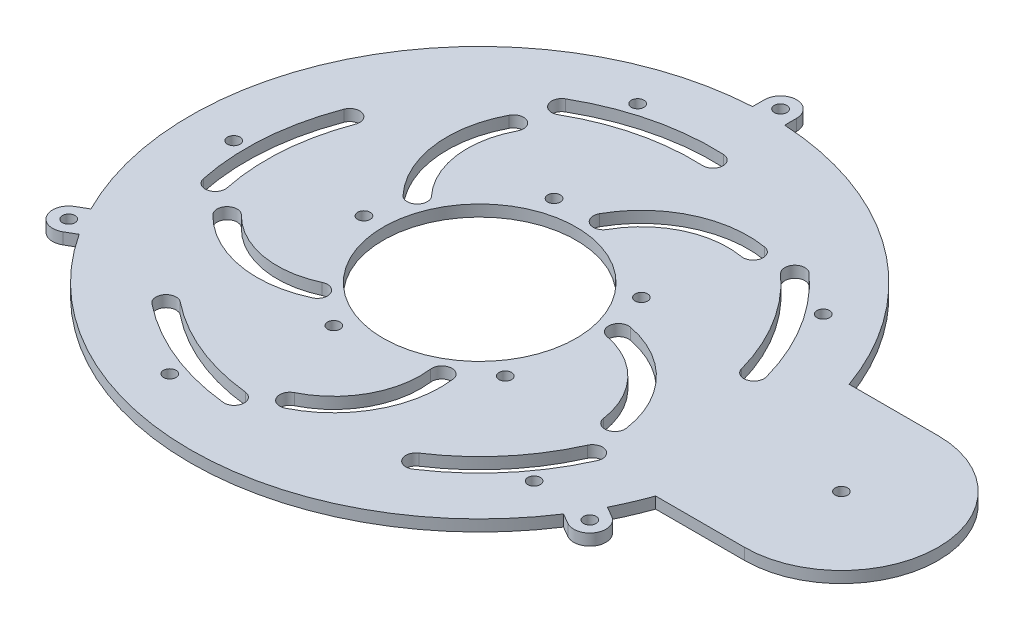
from build123d import *

# Parameters (mm, degrees)
SKETCH1_R           = 50.8
SKETCH1_R_2         = 3.3
BOSS_EXTRUDE1_DEPTH = 6


with BuildPart() as part:
    # Sketch1 → Boss-Extrude1 (new body)
    with BuildSketch(Plane(origin=(0, 0, 0), x_dir=(1, 0, 0), z_dir=(0, 1, 0))):
        with BuildLine():
            Line((190.5, 50.961251532), (143.626985077, 50.961251532))
            ThreePointArc((143.626985077, 50.961251532), (91.342451877, 121.993100154), (8.463835644, 152.16479056))
            Line((8.463835644, 152.16479056), (8.463835644, 158.450241569))
            ThreePointArc((8.463835644, 158.450241569), (0, 166.914077214), (-8.463835644, 158.450241569))
            Line((-8.463835644, 158.450241569), (-8.463835644, 152.16479056))
            ThreePointArc((-8.463835644, 152.16479056), (-131.982271537, 76.2), (-136.010492009, -68.752498599))
            Line((-136.010492009, -68.752498599), (-141.453852257, -71.895224103))
            ThreePointArc((-141.453852257, -71.895224103), (-144.551831116, -83.457038607), (-132.990016613, -86.555017466))
            Line((-132.990016613, -86.555017466), (-127.546656365, -83.412291961))
            ThreePointArc((-127.546656365, -83.412291961), (0, -152.4), (127.546656365, -83.412291961))
            Line((127.546656365, -83.412291961), (132.990016613, -86.555017466))
            ThreePointArc((132.990016613, -86.555017466), (144.551831116, -83.457038607), (141.453852257, -71.895224103))
            Line((141.453852257, -71.895224103), (136.010492009, -68.752498599))
            ThreePointArc((136.010492009, -68.752498599), (140.101433846, -59.977897881), (143.626985077, -50.961251532))
            Line((143.626985077, -50.961251532), (190.5, -50.961251532))
            ThreePointArc((190.5, -50.961251532), (241.461251532, 0), (190.5, 50.961251532))
        make_face()
        with Locations(Location((0, 0, 0), (0, 0, 270))):
            Circle(SKETCH1_R, mode=Mode.SUBTRACT)
        with Locations(Location((-60.96, 0, 0), (0, 0, 270))):
            Circle(SKETCH1_R_2, mode=Mode.SUBTRACT)
        with Locations(Location((-129.54, 0, 0), (0, 0, 270))):
            Circle(SKETCH1_R_2, mode=Mode.SUBTRACT)
        with Locations(Location((-40.030061451, 123.199861121, 0), (0, 0, 270))):
            Circle(SKETCH1_R_2, mode=Mode.SUBTRACT)
        with Locations(Location((-18.837675977, 57.976405233, 0), (0, 0, 270))):
            Circle(SKETCH1_R_2, mode=Mode.SUBTRACT)
        with Locations(Location((104.800061451, 76.141701582, 0), (0, 0, 270))):
            Circle(SKETCH1_R_2, mode=Mode.SUBTRACT)
        with Locations(Location((49.317675977, 35.83138898, 0), (0, 0, 270))):
            Circle(SKETCH1_R_2, mode=Mode.SUBTRACT)
        with Locations(Location((104.800061451, -76.141701582, 0), (0, 0, 270))):
            Circle(SKETCH1_R_2, mode=Mode.SUBTRACT)
        with Locations(Location((49.317675977, -35.83138898, 0), (0, 0, 270))):
            Circle(SKETCH1_R_2, mode=Mode.SUBTRACT)
        with Locations(Location((-40.030061451, -123.199861121, 0), (0, 0, 270))):
            Circle(SKETCH1_R_2, mode=Mode.SUBTRACT)
        with Locations(Location((-18.837675977, -57.976405233, 0), (0, 0, 270))):
            Circle(SKETCH1_R_2, mode=Mode.SUBTRACT)
        with Locations(Location((0, 158.450241569, 0), (0, 0, 270))):
            Circle(SKETCH1_R_2, mode=Mode.SUBTRACT)
        with Locations(Location((137.221934435, -79.225120785, 0), (0, 0, 270))):
            Circle(SKETCH1_R_2, mode=Mode.SUBTRACT)
        with Locations(Location((-137.221934435, -79.225120785, 0), (0, 0, 270))):
            Circle(SKETCH1_R_2, mode=Mode.SUBTRACT)
        with Locations(Location((190.5, 0, 0), (0, 0, 270))):
            Circle(SKETCH1_R_2, mode=Mode.SUBTRACT)
        with BuildLine():
            ThreePointArc((58.830892873, 91.291374091), (24.932369588, 86.543005761), (0.05734711, 63.029389718))
            ThreePointArc((0.05734711, 63.029389718), (2.138397611, 55.817383614), (9.350403715, 57.898434115))
            ThreePointArc((9.350403715, 57.898434115), (29.532704945, 76.976160876), (57.03620605, 80.828740309))
            ThreePointArc((57.03620605, 80.828740309), (63.164866353, 85.162713788), (58.830892873, 91.291374091))
        make_face(mode=Mode.SUBTRACT)
        with BuildLine():
            ThreePointArc((105.003001903, -27.740917993), (90.011815481, 3.031166961), (59.962233041, 19.422612225))
            ThreePointArc((59.962233041, 19.422612225), (53.746287611, 15.214783136), (57.9541167, 8.998837707))
            ThreePointArc((57.9541167, 8.998837707), (82.334787118, -4.30032961), (94.497857139, -29.26720104))
            ThreePointArc((94.497857139, -29.26720104), (100.513571044, -33.756631898), (105.003001903, -27.740917993))
        make_face(mode=Mode.SUBTRACT)
        with BuildLine():
            ThreePointArc((6.064531223, -108.43620429), (30.697991769, -84.669641553), (37.001350951, -51.025555212))
            ThreePointArc((37.001350951, -51.025555212), (31.078634902, -46.414130505), (26.467210194, -52.336846553))
            ThreePointArc((26.467210194, -52.336846553), (21.35299195, -79.633910737), (1.366681525, -98.916865307))
            ThreePointArc((1.366681525, -98.916865307), (-1.044063117, -106.025459647), (6.064531223, -108.43620429))
        make_face(mode=Mode.SUBTRACT)
        with BuildLine():
            ThreePointArc((-101.254915481, -39.276341869), (-71.039413182, -55.359883256), (-37.094140524, -50.958139641))
            ThreePointArc((-37.094140524, -50.958139641), (-34.538634918, -43.900293346), (-41.596481213, -41.34478774))
            ThreePointArc((-41.596481213, -41.34478774), (-69.137912331, -44.916133883), (-93.653201504, -31.866783781))
            ThreePointArc((-93.653201504, -31.866783781), (-101.158837537, -31.770705837), (-101.254915481, -39.276341869))
        make_face(mode=Mode.SUBTRACT)
        with BuildLine():
            ThreePointArc((-68.643510519, 84.162090061), (-74.602763656, 50.455352088), (-59.926790578, 19.53169291))
            ThreePointArc((-59.926790578, 19.53169291), (-52.424685206, 19.282257101), (-52.175249396, 26.784362472))
            ThreePointArc((-52.175249396, 26.784362472), (-64.082571682, 51.874213354), (-59.24754321, 79.222109818))
            ThreePointArc((-59.24754321, 79.222109818), (-61.475536743, 86.390083594), (-68.643510519, 84.162090061))
        make_face(mode=Mode.SUBTRACT)
        with BuildLine():
            ThreePointArc((-114.933952082, 43.33582753), (-122.475383862, 9.358826678), (-120.183999815, -25.369538378))
            ThreePointArc((-120.183999815, -25.369538378), (-113.894475778, -29.466572649), (-109.797441507, -23.177048612))
            ThreePointArc((-109.797441507, -23.177048612), (-111.890799244, 8.55001686), (-105.001114128, 39.590652631))
            ThreePointArc((-105.001114128, 39.590652631), (-108.094945655, 46.429659058), (-114.933952082, 43.33582753))
        make_face(mode=Mode.SUBTRACT)
        with BuildLine():
            ThreePointArc((5.698276738, 122.700191244), (-28.946201909, 119.373048399), (-61.266763184, 106.46215768))
            ThreePointArc((-61.266763184, 106.46215768), (-63.219704511, 99.214411644), (-55.971958475, 97.261470317))
            ThreePointArc((-55.971958475, 97.261470317), (-26.444609232, 109.056574246), (5.205819475, 112.096178291))
            ThreePointArc((5.205819475, 112.096178291), (10.754054583, 117.151956136), (5.698276738, 122.700191244))
        make_face(mode=Mode.SUBTRACT)
        with BuildLine():
            ThreePointArc((118.455680783, 32.497061084), (104.585647237, 64.417774574), (82.319057786, 91.16677034))
            ThreePointArc((82.319057786, 91.16677034), (74.822549631, 90.784451219), (75.204868752, 83.287943063))
            ThreePointArc((75.204868752, 83.287943063), (95.54713192, 58.850652721), (108.218487502, 29.688595562))
            ThreePointArc((108.218487502, 29.688595562), (114.741316904, 25.974231683), (118.455680783, 32.497061084))
        make_face(mode=Mode.SUBTRACT)
        with BuildLine():
            ThreePointArc((67.511360147, -102.615902959), (93.583686637, -79.560674233), (112.142738818, -50.117994966))
            ThreePointArc((112.142738818, -50.117994966), (109.462583308, -43.106535141), (102.451123483, -45.786690651))
            ThreePointArc((102.451123483, -45.786690651), (85.495984285, -72.684870605), (61.676884013, -93.747617155))
            ThreePointArc((61.676884013, -93.747617155), (60.159979178, -101.098998124), (67.511360147, -102.615902959))
        make_face(mode=Mode.SUBTRACT)
        with BuildLine():
            ThreePointArc((-76.731365586, -95.917176899), (-46.747748103, -113.588975417), (-13.011033605, -122.141394676))
            ThreePointArc((-13.011033605, -122.141394676), (-7.17095265, -117.425755073), (-11.886592254, -111.585674118))
            ThreePointArc((-11.886592254, -111.585674118), (-42.70770773, -103.772373223), (-70.100076862, -87.627809328))
            ThreePointArc((-70.100076862, -87.627809328), (-77.56040501, -88.456848752), (-76.731365586, -95.917176899))
        make_face(mode=Mode.SUBTRACT)
    extrude(amount=BOSS_EXTRUDE1_DEPTH)


solid = part.part
